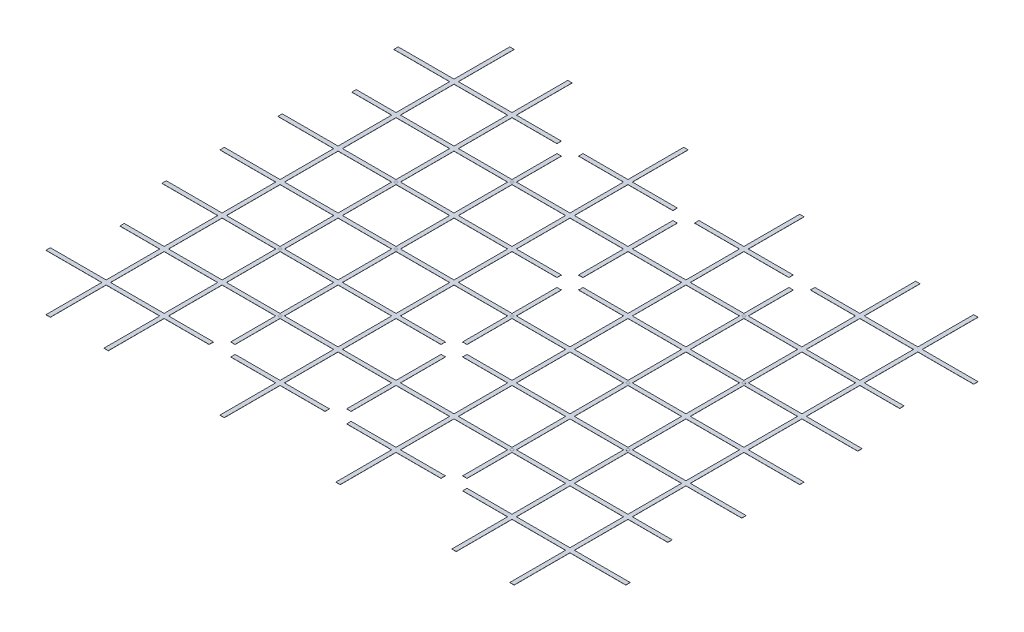
from build123d import *

# Parameters (mm, degrees)
SKETCH_1_W          = 4000
SKETCH_1_H          = 3200
EXTRUDE_1_DEPTH     = 1
SKETCH_2_W          = 370
SKETCH_2_H          = 370
CUT_EXTRUDE_2_DEPTH = 5123.499487555
SKETCH_4_W          = 385
SKETCH_4_H          = 385
CUT_EXTRUDE_4_DEPTH = 5123.499487555
SKETCH_5_W          = 370
SKETCH_5_H          = 15
SKETCH_5_W_2        = 15
SKETCH_5_H_2        = 370
CUT_EXTRUDE_5_DEPTH = 5123.499487555
SKETCH_6_R          = 75
SKETCH_6_W          = 110
SKETCH_6_H          = 30
CUT_EXTRUDE_6_DEPTH = 5123.499487555
SKETCH_7_R          = 10
EXTRUDE_2_DEPTH     = 0.1


with BuildPart() as part:
    # 草图1 → 凸台-拉伸1 (new body)
    with BuildSketch(Plane(origin=(0, 0, 0), x_dir=(1, 0, 0), z_dir=(0, 1, 0))):
        with Locations((2000, 1600)):
            Rectangle(SKETCH_1_W, SKETCH_1_H)
    extrude(amount=EXTRUDE_1_DEPTH)

    # 草图2 → 切除-拉伸2 (cut, through all)
    with BuildSketch(Plane(origin=(0, 1, 0), x_dir=(1, 0, 0), z_dir=(0, 1, 0))):
        with Locations((200, 200)):
            Rectangle(SKETCH_2_W, SKETCH_2_H)
        with Locations((600, 200)):
            Rectangle(SKETCH_2_W, SKETCH_2_H)
        with Locations((1000, 200)):
            Rectangle(SKETCH_2_W, SKETCH_2_H)
        with Locations((1400, 200)):
            Rectangle(SKETCH_2_W, SKETCH_2_H)
        with Locations((1800, 200)):
            Rectangle(SKETCH_2_W, SKETCH_2_H)
        with Locations((2200, 200)):
            Rectangle(SKETCH_2_W, SKETCH_2_H)
        with Locations((2600, 200)):
            Rectangle(SKETCH_2_W, SKETCH_2_H)
        with Locations((3000, 200)):
            Rectangle(SKETCH_2_W, SKETCH_2_H)
        with Locations((3400, 200)):
            Rectangle(SKETCH_2_W, SKETCH_2_H)
        with Locations((3800, 200)):
            Rectangle(SKETCH_2_W, SKETCH_2_H)
        with Locations((600, 600)):
            Rectangle(SKETCH_2_W, SKETCH_2_H)
        with Locations((1000, 600)):
            Rectangle(SKETCH_2_W, SKETCH_2_H)
        with Locations((1400, 600)):
            Rectangle(SKETCH_2_W, SKETCH_2_H)
        with Locations((1800, 600)):
            Rectangle(SKETCH_2_W, SKETCH_2_H)
        with Locations((2200, 600)):
            Rectangle(SKETCH_2_W, SKETCH_2_H)
        with Locations((2600, 600)):
            Rectangle(SKETCH_2_W, SKETCH_2_H)
        with Locations((3000, 600)):
            Rectangle(SKETCH_2_W, SKETCH_2_H)
        with Locations((3400, 600)):
            Rectangle(SKETCH_2_W, SKETCH_2_H)
        with Locations((3800, 600)):
            Rectangle(SKETCH_2_W, SKETCH_2_H)
        with Locations((600, 1000)):
            Rectangle(SKETCH_2_W, SKETCH_2_H)
        with Locations((1000, 1000)):
            Rectangle(SKETCH_2_W, SKETCH_2_H)
        with Locations((1400, 1000)):
            Rectangle(SKETCH_2_W, SKETCH_2_H)
        with Locations((1800, 1000)):
            Rectangle(SKETCH_2_W, SKETCH_2_H)
        with Locations((2200, 1000)):
            Rectangle(SKETCH_2_W, SKETCH_2_H)
        with Locations((2600, 1000)):
            Rectangle(SKETCH_2_W, SKETCH_2_H)
        with Locations((3000, 1000)):
            Rectangle(SKETCH_2_W, SKETCH_2_H)
        with Locations((3400, 1000)):
            Rectangle(SKETCH_2_W, SKETCH_2_H)
        with Locations((3800, 1000)):
            Rectangle(SKETCH_2_W, SKETCH_2_H)
        with Locations((600, 1400)):
            Rectangle(SKETCH_2_W, SKETCH_2_H)
        with Locations((1000, 1400)):
            Rectangle(SKETCH_2_W, SKETCH_2_H)
        with Locations((1400, 1400)):
            Rectangle(SKETCH_2_W, SKETCH_2_H)
        with Locations((1800, 1400)):
            Rectangle(SKETCH_2_W, SKETCH_2_H)
        with Locations((2200, 1400)):
            Rectangle(SKETCH_2_W, SKETCH_2_H)
        with Locations((2600, 1400)):
            Rectangle(SKETCH_2_W, SKETCH_2_H)
        with Locations((3000, 1400)):
            Rectangle(SKETCH_2_W, SKETCH_2_H)
        with Locations((3400, 1400)):
            Rectangle(SKETCH_2_W, SKETCH_2_H)
        with Locations((3800, 1400)):
            Rectangle(SKETCH_2_W, SKETCH_2_H)
        with Locations((600, 1800)):
            Rectangle(SKETCH_2_W, SKETCH_2_H)
        with Locations((1000, 1800)):
            Rectangle(SKETCH_2_W, SKETCH_2_H)
        with Locations((1400, 1800)):
            Rectangle(SKETCH_2_W, SKETCH_2_H)
        with Locations((1800, 1800)):
            Rectangle(SKETCH_2_W, SKETCH_2_H)
        with Locations((2200, 1800)):
            Rectangle(SKETCH_2_W, SKETCH_2_H)
        with Locations((2600, 1800)):
            Rectangle(SKETCH_2_W, SKETCH_2_H)
        with Locations((3000, 1800)):
            Rectangle(SKETCH_2_W, SKETCH_2_H)
        with Locations((3400, 1800)):
            Rectangle(SKETCH_2_W, SKETCH_2_H)
        with Locations((3800, 1800)):
            Rectangle(SKETCH_2_W, SKETCH_2_H)
        with Locations((600, 2200)):
            Rectangle(SKETCH_2_W, SKETCH_2_H)
        with Locations((1000, 2200)):
            Rectangle(SKETCH_2_W, SKETCH_2_H)
        with Locations((1400, 2200)):
            Rectangle(SKETCH_2_W, SKETCH_2_H)
        with Locations((1800, 2200)):
            Rectangle(SKETCH_2_W, SKETCH_2_H)
        with Locations((2200, 2200)):
            Rectangle(SKETCH_2_W, SKETCH_2_H)
        with Locations((2600, 2200)):
            Rectangle(SKETCH_2_W, SKETCH_2_H)
        with Locations((3000, 2200)):
            Rectangle(SKETCH_2_W, SKETCH_2_H)
        with Locations((3400, 2200)):
            Rectangle(SKETCH_2_W, SKETCH_2_H)
        with Locations((3800, 2200)):
            Rectangle(SKETCH_2_W, SKETCH_2_H)
        with Locations((600, 2600)):
            Rectangle(SKETCH_2_W, SKETCH_2_H)
        with Locations((1000, 2600)):
            Rectangle(SKETCH_2_W, SKETCH_2_H)
        with Locations((1400, 2600)):
            Rectangle(SKETCH_2_W, SKETCH_2_H)
        with Locations((1800, 2600)):
            Rectangle(SKETCH_2_W, SKETCH_2_H)
        with Locations((2200, 2600)):
            Rectangle(SKETCH_2_W, SKETCH_2_H)
        with Locations((2600, 2600)):
            Rectangle(SKETCH_2_W, SKETCH_2_H)
        with Locations((3000, 2600)):
            Rectangle(SKETCH_2_W, SKETCH_2_H)
        with Locations((3400, 2600)):
            Rectangle(SKETCH_2_W, SKETCH_2_H)
        with Locations((3800, 2600)):
            Rectangle(SKETCH_2_W, SKETCH_2_H)
        with Locations((600, 3000)):
            Rectangle(SKETCH_2_W, SKETCH_2_H)
        with Locations((1000, 3000)):
            Rectangle(SKETCH_2_W, SKETCH_2_H)
        with Locations((1400, 3000)):
            Rectangle(SKETCH_2_W, SKETCH_2_H)
        with Locations((1800, 3000)):
            Rectangle(SKETCH_2_W, SKETCH_2_H)
        with Locations((2200, 3000)):
            Rectangle(SKETCH_2_W, SKETCH_2_H)
        with Locations((2600, 3000)):
            Rectangle(SKETCH_2_W, SKETCH_2_H)
        with Locations((3000, 3000)):
            Rectangle(SKETCH_2_W, SKETCH_2_H)
        with Locations((3400, 3000)):
            Rectangle(SKETCH_2_W, SKETCH_2_H)
        with Locations((3800, 3000)):
            Rectangle(SKETCH_2_W, SKETCH_2_H)
        with Locations((200, 600)):
            Rectangle(SKETCH_2_W, SKETCH_2_H)
        with Locations((200, 1000)):
            Rectangle(SKETCH_2_W, SKETCH_2_H)
        with Locations((200, 1400)):
            Rectangle(SKETCH_2_W, SKETCH_2_H)
        with Locations((200, 1800)):
            Rectangle(SKETCH_2_W, SKETCH_2_H)
        with Locations((200, 2200)):
            Rectangle(SKETCH_2_W, SKETCH_2_H)
        with Locations((200, 2600)):
            Rectangle(SKETCH_2_W, SKETCH_2_H)
        with Locations((200, 3000)):
            Rectangle(SKETCH_2_W, SKETCH_2_H)
    extrude(amount=-CUT_EXTRUDE_2_DEPTH, mode=Mode.SUBTRACT)

    # 草图4 → 切除-拉伸4 (cut, through all)
    with BuildSketch(Plane(origin=(0, 1, 0), x_dir=(1, 0, 0), z_dir=(0, 1, 0))):
        with Locations((192.5, 3007.5)):
            Rectangle(SKETCH_4_W, SKETCH_4_H)
        with Locations((3807.5, 3007.5)):
            Rectangle(SKETCH_4_W, SKETCH_4_H)
        with Locations((3807.5, 192.5)):
            Rectangle(SKETCH_4_W, SKETCH_4_H)
        with Locations((192.5, 192.5)):
            Rectangle(SKETCH_4_W, SKETCH_4_H)
    extrude(amount=-CUT_EXTRUDE_4_DEPTH, mode=Mode.SUBTRACT)

    # 草图5 → 切除-拉伸5 (cut, through all)
    with BuildSketch(Plane(origin=(0, 1, 0), x_dir=(1, 0, 0), z_dir=(0, 1, 0))):
        with Locations((600, 7.5)):
            Rectangle(SKETCH_5_W, SKETCH_5_H)
        with Locations((1000, 7.5)):
            Rectangle(SKETCH_5_W, SKETCH_5_H)
        with Locations((1400, 7.5)):
            Rectangle(SKETCH_5_W, SKETCH_5_H)
        with Locations((1800, 7.5)):
            Rectangle(SKETCH_5_W, SKETCH_5_H)
        with Locations((2200, 7.5)):
            Rectangle(SKETCH_5_W, SKETCH_5_H)
        with Locations((2600, 7.5)):
            Rectangle(SKETCH_5_W, SKETCH_5_H)
        with Locations((3000, 7.5)):
            Rectangle(SKETCH_5_W, SKETCH_5_H)
        with Locations((3400, 7.5)):
            Rectangle(SKETCH_5_W, SKETCH_5_H)
        with Locations((1000, 3192.5)):
            Rectangle(SKETCH_5_W, SKETCH_5_H)
        with Locations((1400, 3192.5)):
            Rectangle(SKETCH_5_W, SKETCH_5_H)
        with Locations((1800, 3192.5)):
            Rectangle(SKETCH_5_W, SKETCH_5_H)
        with Locations((2200, 3192.5)):
            Rectangle(SKETCH_5_W, SKETCH_5_H)
        with Locations((2600, 3192.5)):
            Rectangle(SKETCH_5_W, SKETCH_5_H)
        with Locations((3000, 3192.5)):
            Rectangle(SKETCH_5_W, SKETCH_5_H)
        with Locations((3400, 3192.5)):
            Rectangle(SKETCH_5_W, SKETCH_5_H)
        with Locations((600, 3192.5)):
            Rectangle(SKETCH_5_W, SKETCH_5_H)
        with Locations((7.5, 600)):
            Rectangle(SKETCH_5_W_2, SKETCH_5_H_2)
        with Locations((3992.5, 600)):
            Rectangle(SKETCH_5_W_2, SKETCH_5_H_2)
        with Locations((3992.5, 1000)):
            Rectangle(SKETCH_5_W_2, SKETCH_5_H_2)
        with Locations((3992.5, 1400)):
            Rectangle(SKETCH_5_W_2, SKETCH_5_H_2)
        with Locations((3992.5, 1800)):
            Rectangle(SKETCH_5_W_2, SKETCH_5_H_2)
        with Locations((3992.5, 2200)):
            Rectangle(SKETCH_5_W_2, SKETCH_5_H_2)
        with Locations((3992.5, 2600)):
            Rectangle(SKETCH_5_W_2, SKETCH_5_H_2)
        with Locations((7.5, 1000)):
            Rectangle(SKETCH_5_W_2, SKETCH_5_H_2)
        with Locations((7.5, 1400)):
            Rectangle(SKETCH_5_W_2, SKETCH_5_H_2)
        with Locations((7.5, 1800)):
            Rectangle(SKETCH_5_W_2, SKETCH_5_H_2)
        with Locations((7.5, 2200)):
            Rectangle(SKETCH_5_W_2, SKETCH_5_H_2)
        with Locations((7.5, 2600)):
            Rectangle(SKETCH_5_W_2, SKETCH_5_H_2)
    extrude(amount=-CUT_EXTRUDE_5_DEPTH, mode=Mode.SUBTRACT)

    # 草图6 → 切除-拉伸6 (cut, through all)
    with BuildSketch(Plane(origin=(0, 1, 0), x_dir=(1, 0, 0), z_dir=(0, 1, 0))):
        with Locations((2000, 2000)):
            Circle(SKETCH_6_R)
        with Locations((2000, 1200)):
            Circle(SKETCH_6_R)
        with Locations((55, 2400)):
            Rectangle(SKETCH_6_W, SKETCH_6_H)
        with Locations((55, 800)):
            Rectangle(SKETCH_6_W, SKETCH_6_H)
        with Locations((3945, 800)):
            Rectangle(SKETCH_6_W, SKETCH_6_H)
        with Locations((3945, 2400)):
            Rectangle(SKETCH_6_W, SKETCH_6_H)
        with BuildLine():
            Line((1125, 3200), (1275, 3200))
            Line((1275, 3200), (1275, 2800))
            ThreePointArc((1275, 2800), (1200, 2725), (1125, 2800))
            Line((1125, 2800), (1125, 3200))
        make_face()
        with BuildLine():
            Line((1925, 3200), (2075, 3200))
            Line((2075, 3200), (2075, 2800))
            ThreePointArc((2075, 2800), (2000, 2725), (1925, 2800))
            Line((1925, 2800), (1925, 3200))
        make_face()
        with BuildLine():
            Line((2725, 3200), (2875, 3200))
            Line((2875, 3200), (2875, 2800))
            ThreePointArc((2875, 2800), (2800, 2725), (2725, 2800))
            Line((2725, 2800), (2725, 3200))
        make_face()
        with BuildLine():
            Line((2875, 0), (2875, 400))
            ThreePointArc((2875, 400), (2800, 475), (2725, 400))
            Line((2725, 400), (2725, 0))
            Line((2725, 0), (2875, 0))
        make_face()
        with BuildLine():
            Line((2075, 0), (2075, 400))
            ThreePointArc((2075, 400), (2000, 475), (1925, 400))
            Line((1925, 400), (1925, 0))
            Line((1925, 0), (2075, 0))
        make_face()
        with BuildLine():
            Line((1275, 0), (1275, 400))
            ThreePointArc((1275, 400), (1200, 475), (1125, 400))
            Line((1125, 400), (1125, 0))
            Line((1125, 0), (1275, 0))
        make_face()
    extrude(amount=-CUT_EXTRUDE_6_DEPTH, mode=Mode.SUBTRACT)

    # 草图7 → 凸台-拉伸2 (add)
    with BuildSketch(Plane(origin=(0, 1, 0), x_dir=(1, 0, 0), z_dir=(0, 1, 0))):
        with Locations(Location((1200, 2400, 0), (0, 0, 90))):
            Circle(SKETCH_7_R)
        with Locations(Location((1200, 1600, 0), (0, 0, 90))):
            Circle(SKETCH_7_R)
        with Locations(Location((1200, 800, 0), (0, 0, 90))):
            Circle(SKETCH_7_R)
        with Locations(Location((800, 2000, 0), (0, 0, 90))):
            Circle(SKETCH_7_R)
        with Locations(Location((800, 1200, 0), (0, 0, 90))):
            Circle(SKETCH_7_R)
        with Locations(Location((2000, 1600, 0), (0, 0, 90))):
            Circle(SKETCH_7_R)
        with Locations(Location((2800, 800, 0), (0, 0, 90))):
            Circle(SKETCH_7_R)
        with Locations(Location((3200, 1200, 0), (0, 0, 90))):
            Circle(SKETCH_7_R)
        with Locations(Location((2800, 1600, 0), (0, 0, 90))):
            Circle(SKETCH_7_R)
        with Locations(Location((3200, 2000, 0), (0, 0, 90))):
            Circle(SKETCH_7_R)
        with Locations(Location((2800, 2400, 0), (0, 0, 90))):
            Circle(SKETCH_7_R)
    extrude(amount=EXTRUDE_2_DEPTH)


solid = part.part
